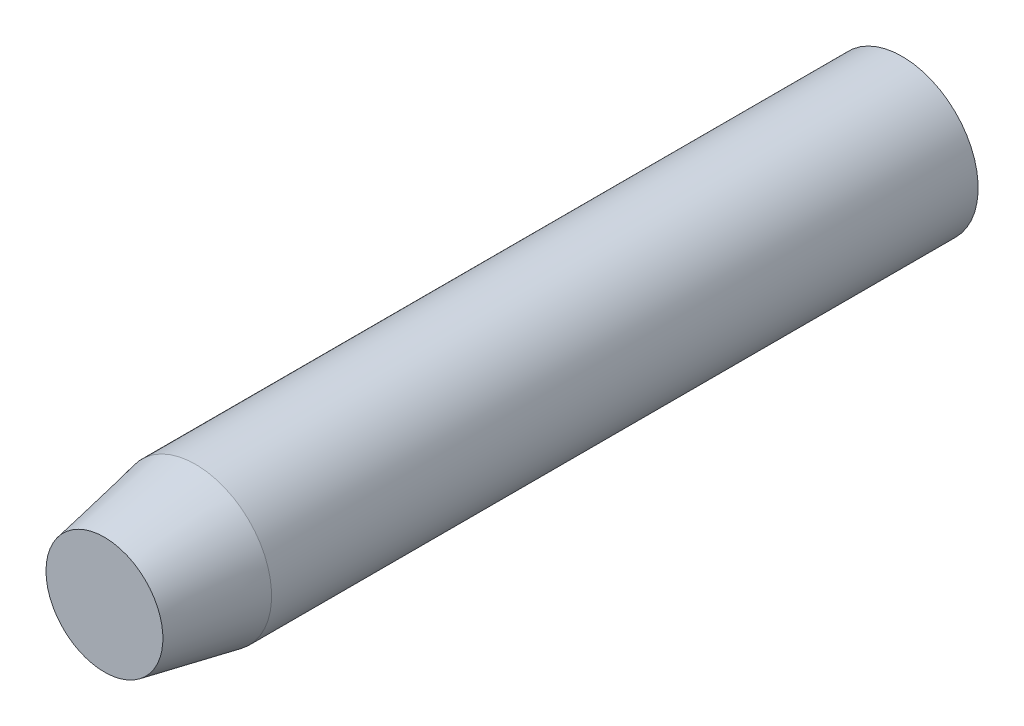
from build123d import *


with BuildPart() as part:
    # Sketch2 → Revolve1 (revolve)
    with BuildSketch(Plane(origin=(0, 0, 0), x_dir=(1, 0, 0), z_dir=(0, 1, 0))):
        Polygon((-14.45, 28.68125), (-11.05, 28.68125), (-11.05, -32.015881599), (-7.95, -32.015881599), (-7.95, -39.56875), (-12.95, -39.56875), (-14.45, -31.76875), align=None)
    revolve(axis=Axis((-7.95, 0, -45.36875), (0, 0, 1)))


solid = part.part
